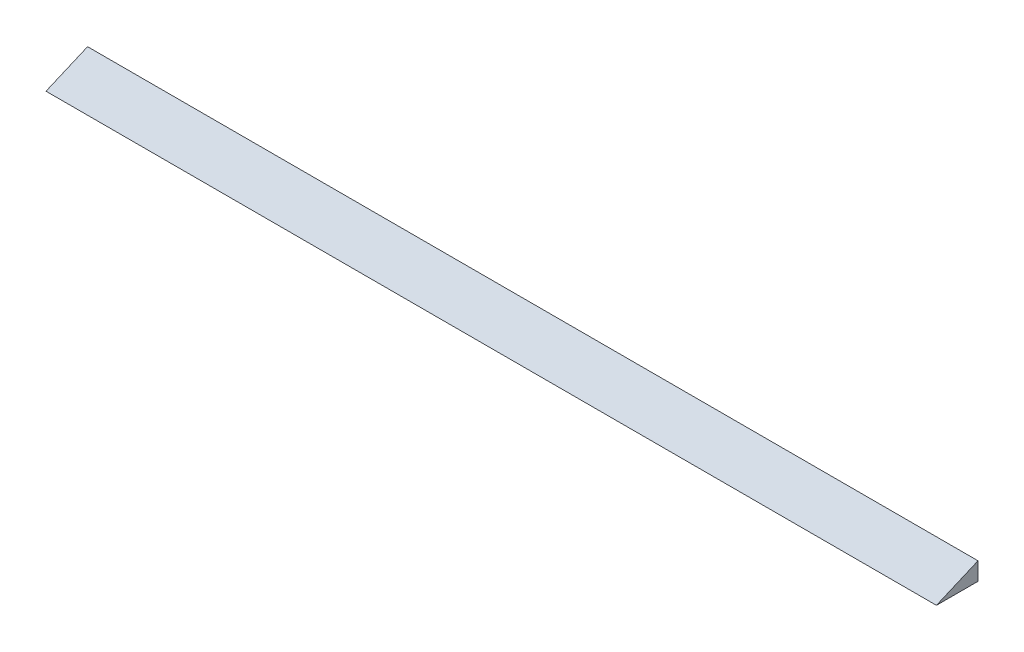
from build123d import *

# Parameters (mm, degrees)
EXTRUDE_1_DEPTH = 75


with BuildPart() as part:
    # 스케치1 → 보스-돌출1 (new, symmetric)
    with BuildSketch(Plane(origin=(0, 0, 0), x_dir=(0, 0, -1), z_dir=(1, 0, 0))):
        Polygon((0, 0), (0, 3), (-7, 0), align=None)
    extrude(amount=EXTRUDE_1_DEPTH, both=True)


solid = part.part
